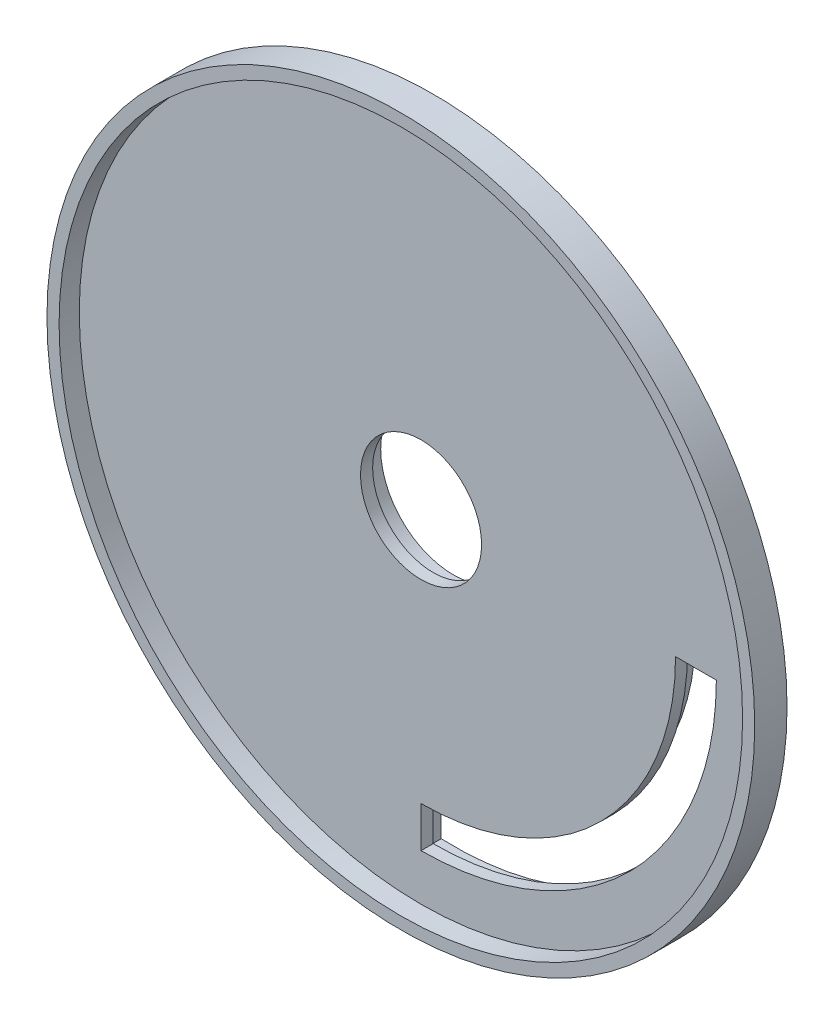
from build123d import *

# Parameters (mm, degrees)
SKETCH_1_R          = 87.6
EXTRUDE_1_DEPTH     = 3
SKETCH_3_R          = 87.6
SKETCH_3_R_2        = 84.6
EXTRUDE_2_DEPTH     = 5
CUT_EXTRUDE_1_DEPTH = 5
EXTRUDE_3_DEPTH     = 5
SKETCH_6_R          = 14.982595121
CUT_EXTRUDE_2_DEPTH = 5
SKETCH_7_R          = 20.982595121
SKETCH_7_R_2        = 17.982595121
EXTRUDE_4_DEPTH     = 5


with BuildPart() as part:
    # 스케치1 → 보스-돌출1 (new body)
    with BuildSketch(Plane.XY):
        Circle(SKETCH_1_R)
    extrude(amount=EXTRUDE_1_DEPTH)

    # 스케치3 → 보스-돌출2 (add)
    with BuildSketch(Plane.XY.offset(3)):
        Circle(SKETCH_3_R)
        Circle(SKETCH_3_R_2, mode=Mode.SUBTRACT)
    extrude(amount=EXTRUDE_2_DEPTH)

    # 스케치4 → 컷-돌출1 (cut)
    with BuildSketch(Plane(origin=(0, 0, 0), x_dir=(-1, 0, 0), z_dir=(0, 0, -1))):
        with BuildLine():
            Line((-63, 0), (-73.1, 0))
            ThreePointArc((-73.1, 0), (-51.689505705, -51.689505705), (0, -73.1))
            Line((0, -73.1), (0, -63))
            ThreePointArc((0, -63), (-44.547727215, -44.547727215), (-63, 0))
        make_face()
    extrude(amount=-CUT_EXTRUDE_1_DEPTH, mode=Mode.SUBTRACT)

    # 스케치5 → 보스-돌출3 (add)
    with BuildSketch(Plane(origin=(0, 0, 0), x_dir=(-1, 0, 0), z_dir=(0, 0, -1))):
        with BuildLine():
            Line((6, -78.872111675), (6, -56.683330883))
            ThreePointArc((6, -56.683330883), (-40.305086528, -40.305086528), (-56.683330883, 6))
            Line((-56.683330883, 6), (-78.872111675, 6))
            ThreePointArc((-78.872111675, 6), (-55.932146392, -55.932146392), (6, -78.872111675))
        make_face()
        with BuildLine():
            Line((-59.924953066, 3), (-76.040844288, 3))
            ThreePointArc((-76.040844288, 3), (-53.810826048, -53.810826048), (3, -76.040844288))
            Line((3, -76.040844288), (3, -59.924953066))
            ThreePointArc((3, -59.924953066), (-42.426406871, -42.426406871), (-59.924953066, 3))
        make_face(mode=Mode.SUBTRACT)
    extrude(amount=EXTRUDE_3_DEPTH)

    # 스케치6 → 컷-돌출2 (cut)
    with BuildSketch(Plane(origin=(0, 0, 0), x_dir=(-1, 0, 0), z_dir=(0, 0, -1))):
        Circle(SKETCH_6_R)
    extrude(amount=-CUT_EXTRUDE_2_DEPTH, mode=Mode.SUBTRACT)

    # 스케치7 → 보스-돌출4 (add)
    with BuildSketch(Plane(origin=(0, 0, 0), x_dir=(-1, 0, 0), z_dir=(0, 0, -1))):
        with Locations(Location((0, 0, 0), (0, 0, 180))):
            Circle(SKETCH_7_R)
        Circle(SKETCH_7_R_2, mode=Mode.SUBTRACT)
    extrude(amount=EXTRUDE_4_DEPTH)


solid = part.part
